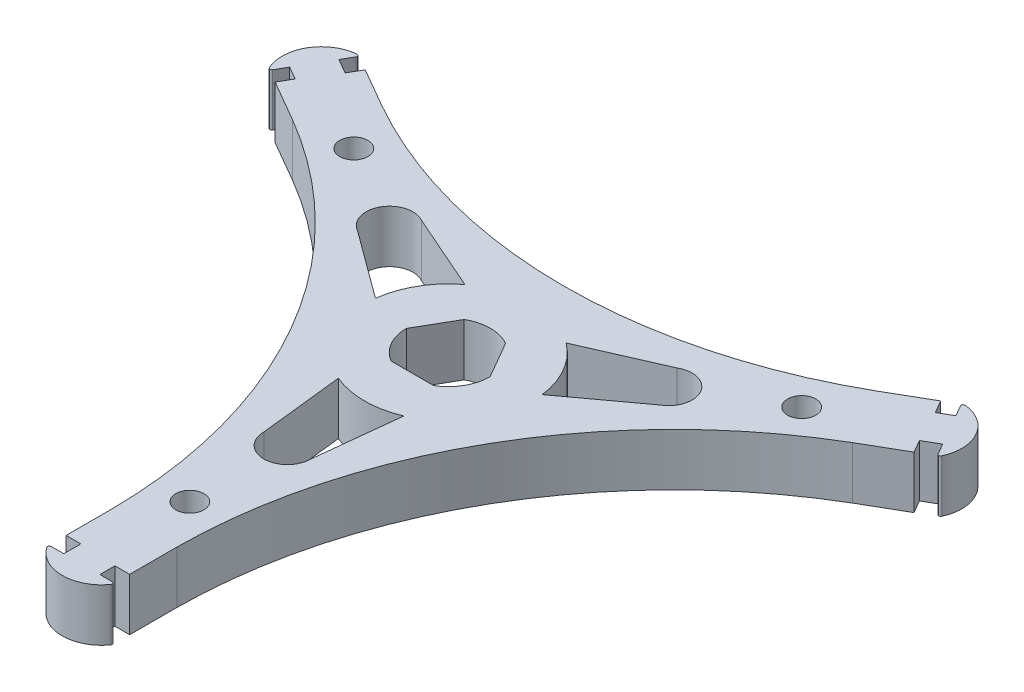
from build123d import *

# Parameters (mm, degrees)
BOSS_EXTRUDE1_DEPTH          = 8
CUT_EXTRUDE1_DEPTH           = 10
ESQUISSE1_W                  = 10
ESQUISSE1_H                  = 25.654784636
BOSS_EXTRU_1_DEPTH           = 8
R_P_TITION_CIRCULAIRE3_COUNT = 3
ESQUISSE3_R                  = 2.15
ENL_V_MAT_EXTRU_1_DEPTH      = 8
BOSS_EXTRU_4_DEPTH           = 8
R_P_TITION_CIRCULAIRE4_COUNT = 3
BOSS_EXTRU_5_DEPTH           = 8
R_P_TITION_CIRCULAIRE5_COUNT = 3
ENL_V_MAT_EXTRU_4_DEPTH      = 10


with BuildPart() as part:
    # Sketch1 → Boss-Extrude1 (new body)
    with BuildSketch(Plane(origin=(0, 0, 0), x_dir=(1, 0, 0), z_dir=(0, 1, 0))):
        Polygon((0, 22.607508486), (-18.985035039, 16.354559035), (-23.655981112, 8.264243118), (-19.578676665, -11.303754243), (-4.670946073, -24.618802154), (4.670946073, -24.618802154), (19.578676665, -11.303754243), (23.655981112, 8.264243118), (18.985035039, 16.354559035), align=None)
        with BuildLine():
            Line((-3.15901992, 5.566021303), (-6.399825806, -0.047219149))
            ThreePointArc((-6.399825806, -0.047219149), (-5.542562584, -3.2), (-3.240805886, -5.518802154))
            Line((-3.240805886, -5.518802154), (3.240805886, -5.518802154))
            ThreePointArc((3.240805886, -5.518802154), (5.542562584, -3.2), (6.399825806, -0.047219149))
            Line((6.399825806, -0.047219149), (3.15901992, 5.566021303))
            ThreePointArc((3.15901992, 5.566021303), (0, 6.4), (-3.15901992, 5.566021303))
        make_face(mode=Mode.SUBTRACT)
    extrude(amount=BOSS_EXTRUDE1_DEPTH)

    # Sketch3 → Cut-Extrude1 (cut)
    with BuildSketch(Plane(origin=(0, 8, 0), x_dir=(1, 0, 0), z_dir=(0, 1, 0))):
        with BuildLine():
            Line((-18.985035039, 16.354559035), (0, 25.029979083))
            Line((0, 25.029979083), (18.985035039, 16.354559035))
            ThreePointArc((18.985035039, 16.354559035), (0, 11.607508486), (-18.985035039, 16.354559035))
        make_face()
        with BuildLine():
            Line((23.655981112, 8.264243118), (24.53433034, -16.532203716))
            Line((24.53433034, -16.532203716), (4.670946073, -24.618802154))
            ThreePointArc((4.670946073, -24.618802154), (10.052397223, -5.803754243), (23.655981112, 8.264243118))
        make_face()
        with BuildLine():
            Line((-23.655981112, 8.264243118), (-26.351688143, -12.502410327))
            Line((-26.351688143, -12.502410327), (-4.670946073, -24.618802154))
            ThreePointArc((-4.670946073, -24.618802154), (-10.052397223, -5.803754243), (-23.655981112, 8.264243118))
        make_face()
    extrude(amount=-CUT_EXTRUDE1_DEPTH, mode=Mode.SUBTRACT)

    # Esquisse1 → Boss.-Extru.1 (add)
    with BuildSketch(Plane.XZ):
        with Locations((0, 33.672607682)):
            Rectangle(ESQUISSE1_W, ESQUISSE1_H)
    boss_extru_1 = extrude(amount=-BOSS_EXTRU_1_DEPTH)

    # Répétition circulaire3: Boss.-Extru.1 ×3 about axis
    r_p_tition_circulaire3_axis = Axis((0, 0, 0), (0, 1, 0))
    for i in range(1, R_P_TITION_CIRCULAIRE3_COUNT):
        add(boss_extru_1.rotate(r_p_tition_circulaire3_axis, i * 360 / R_P_TITION_CIRCULAIRE3_COUNT))

    # Esquisse3 → Enlèv. mat.-Extru.1 (cut)
    with BuildSketch(Plane(origin=(0, 8, 0), x_dir=(1, 0, 0), z_dir=(0, 1, 0))):
        with Locations((0, -39.5)):
            Circle(ESQUISSE3_R)
        with Locations((34.208003449, 19.75)):
            Circle(ESQUISSE3_R)
        with Locations((-34.208003449, 19.75)):
            Circle(ESQUISSE3_R)
    extrude(amount=-ENL_V_MAT_EXTRU_1_DEPTH, mode=Mode.SUBTRACT)

    # Esquisse5 → Boss.-Extru.4 (add)
    with BuildSketch(Plane(origin=(0, 8, 0), x_dir=(1, 0, 0), z_dir=(0, 1, 0))):
        with BuildLine():
            Line((-5, -46.5), (5, -46.5))
            Line((5, -46.5), (5, -53.7))
            Line((5, -53.7), (2.75, -53.7))
            Line((2.75, -53.7), (2.75, -56))
            Line((2.75, -56), (4.647580015, -56))
            ThreePointArc((4.647580015, -56), (4.91413701, -56.16235056), (4.89218949, -56.473684211))
            ThreePointArc((4.89218949, -56.473684211), (0, -59), (-4.89218949, -56.473684211))
            ThreePointArc((-4.89218949, -56.473684211), (-4.91413701, -56.16235056), (-4.647580015, -56))
            Line((-4.647580015, -56), (-2.75, -56))
            Line((-2.75, -56), (-2.75, -53.4))
            Line((-2.75, -53.4), (-5, -53.4))
            Line((-5, -53.4), (-5, -46.5))
        make_face()
    boss_extru_4 = extrude(amount=-BOSS_EXTRU_4_DEPTH)

    # Répétition circulaire4: Boss.-Extru.4 ×3 about axis
    r_p_tition_circulaire4_axis = Axis((0, 0, 0), (0, 1, 0))
    for i in range(1, R_P_TITION_CIRCULAIRE4_COUNT):
        add(boss_extru_4.rotate(r_p_tition_circulaire4_axis, i * 360 / R_P_TITION_CIRCULAIRE4_COUNT))

    # Esquisse6 → Boss.-Extru.5 (add)
    with BuildSketch(Plane(origin=(0, 8, 0), x_dir=(1, 0, 0), z_dir=(0, 1, 0))):
        with BuildLine():
            Line((4.242203457, -21.192425308), (5, -46.5))
            ThreePointArc((5, -46.5), (15.232576769, -8.794532298), (42.770181276, 18.919872981))
            Line((42.770181276, 18.919872981), (24.63344488, 10.3797127))
            Line((24.63344488, 10.3797127), (9.134543243, -3.221955174))
            Line((9.134543243, -3.221955174), (4.242203457, -21.192425308))
        make_face()
    boss_extru_5 = extrude(amount=-BOSS_EXTRU_5_DEPTH)

    # Répétition circulaire5: Boss.-Extru.5 ×3 about axis
    r_p_tition_circulaire5_axis = Axis((0, 0, 0), (0, 1, 0))
    for i in range(1, R_P_TITION_CIRCULAIRE5_COUNT):
        add(boss_extru_5.rotate(r_p_tition_circulaire5_axis, i * 360 / R_P_TITION_CIRCULAIRE5_COUNT))

    # Esquisse12 → Enlèv. mat.-Extru.4 (cut)
    with BuildSketch(Plane(origin=(0, 8, 0), x_dir=(1, 0, 0), z_dir=(0, 1, 0))):
        with BuildLine():
            Line((-7.735382907, 10.239528096), (-19.528767297, 15.41278714))
            ThreePointArc((-19.528767297, 15.41278714), (-24.423894139, 14.101141856), (-23.112248854, 9.206015014))
            Line((-23.112248854, 9.206015014), (-12.735382907, 1.579274058))
            ThreePointArc((-12.735382907, 1.579274058), (-11.113643114, 6.416464843), (-7.735382907, 10.239528096))
        make_face()
        with BuildLine():
            Line((-5, -11.818802154), (-3.583481558, -24.618802154))
            ThreePointArc((-3.583481558, -24.618802154), (0, -28.202283711), (3.583481558, -24.618802154))
            Line((3.583481558, -24.618802154), (5, -11.818802154))
            ThreePointArc((5, -11.818802154), (0, -12.832929687), (-5, -11.818802154))
        make_face()
        with BuildLine():
            Line((12.735382907, 1.579274058), (23.112248854, 9.206015014))
            ThreePointArc((23.112248854, 9.206015014), (24.423894139, 14.101141856), (19.528767297, 15.41278714))
            Line((19.528767297, 15.41278714), (7.735382907, 10.239528096))
            ThreePointArc((7.735382907, 10.239528096), (11.113643114, 6.416464843), (12.735382907, 1.579274058))
        make_face()
    extrude(amount=-ENL_V_MAT_EXTRU_4_DEPTH, mode=Mode.SUBTRACT)


solid = part.part
